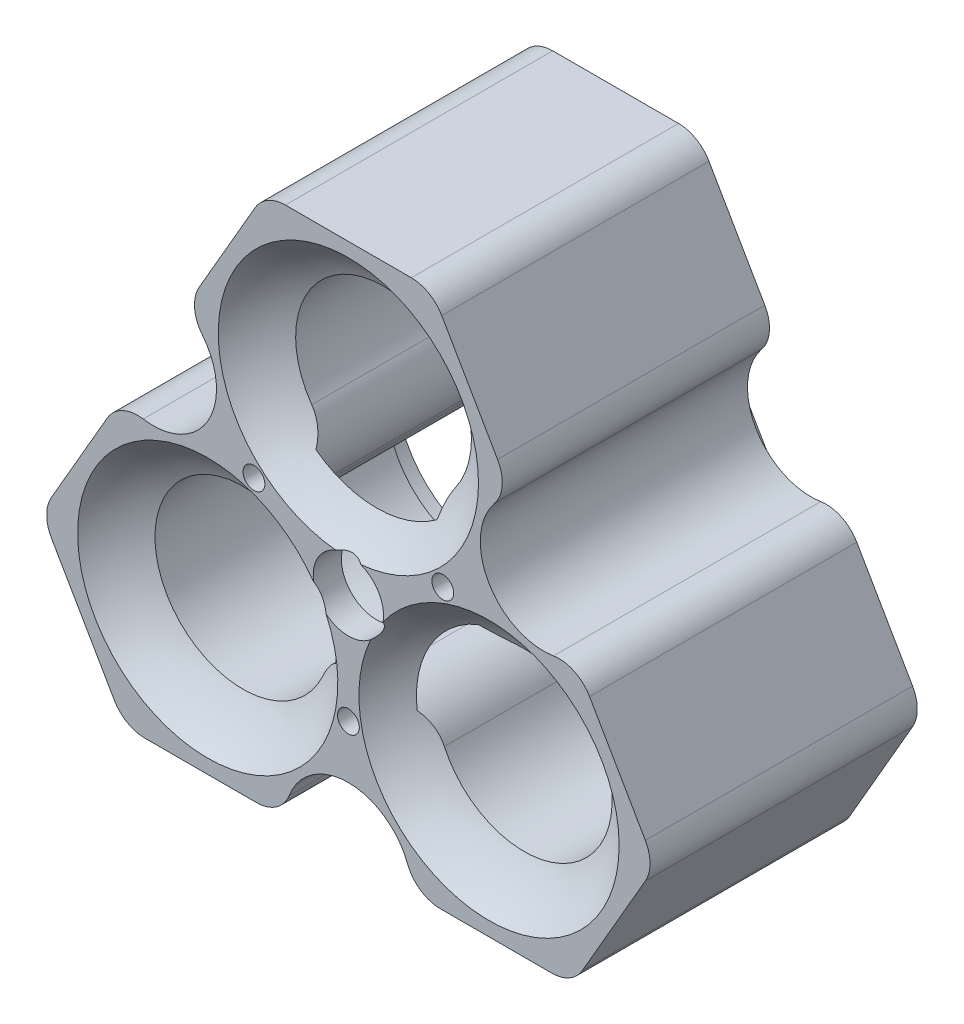
from build123d import *

# Parameters (mm, degrees)
EXTRUDE_3_DEPTH          = 38
CUT_EXTRUDE_2_DEPTH      = 34
PATTERN_CIRCULAR_2_COUNT = 3
SKETCH_1_8_R             = 5
CUT_EXTRUDE_4_DEPTH      = 38
FILLET_2_R               = 5
SKETCH_12_R              = 1.55
CUT_EXTRUDE_5_DEPTH      = 38
SKETCH_17_W              = 6
SKETCH_17_H              = 1.5


with BuildPart() as part:
    # 草图8 → 凸台-拉伸3 (new body)
    with BuildSketch(Plane.XY):
        with BuildLine():
            Line((11.835680518, 43.594010768), (-11.835680518, 43.594010768))
            Line((-11.835680518, 43.594010768), (-23.253520778, 23.817731326))
            ThreePointArc((-23.253520778, 23.817731326), (-19.959292144, 20.523502692), (-18.753520778, 16.023502692))
            ThreePointArc((-18.753520778, 16.023502692), (-23.253520778, 8.229274058), (-32.253520778, 8.229274058))
            Line((-32.253520778, 8.229274058), (-43.671361037, -11.547005384))
            Line((-43.671361037, -11.547005384), (-31.835680518, -32.047005384))
            Line((-31.835680518, -32.047005384), (-9, -32.047005384))
            ThreePointArc((-9, -32.047005384), (0, -23.047005384), (9, -32.047005384))
            Line((9, -32.047005384), (31.835680518, -32.047005384))
            Line((31.835680518, -32.047005384), (43.671361037, -11.547005384))
            Line((43.671361037, -11.547005384), (32.253520778, 8.229274058))
            ThreePointArc((32.253520778, 8.229274058), (19.959292144, 11.523502692), (23.253520778, 23.817731326))
            Line((23.253520778, 23.817731326), (11.835680518, 43.594010768))
        make_face()
    extrude(amount=EXTRUDE_3_DEPTH)

    # 草图1 → 切除-拉伸2 (cut)
    with BuildSketch(Plane.XY):
        with BuildLine():
            ThreePointArc((-10.207581819, 15.879076713), (-8.566497102, 11.096786669), (-9.762812095, 6.184324194))
            Line((-9.762812095, 6.184324194), (-10.237187905, 5.362681189))
            ThreePointArc((-10.237187905, 5.362681189), (-13.893347706, 1.870410777), (-18.855474732, 0.90048681))
            ThreePointArc((-18.855474732, 0.90048681), (-30.825317547, -17.797005384), (-8.647892913, -16.779563523))
            ThreePointArc((-8.647892913, -16.779563523), (-5.326850604, -12.967197446), (-0.47437581, -11.547005384))
            Line((-0.47437581, -11.547005384), (0.47437581, -11.547005384))
            ThreePointArc((0.47437581, -11.547005384), (5.326850604, -12.967197446), (8.647892913, -16.779563523))
            ThreePointArc((8.647892913, -16.779563523), (30.825317547, -17.797005384), (18.855474732, 0.90048681))
            ThreePointArc((18.855474732, 0.90048681), (13.893347706, 1.870410778), (10.237187905, 5.362681189))
            Line((10.237187905, 5.362681189), (9.762812095, 6.184324195))
            ThreePointArc((9.762812095, 6.184324195), (8.566497102, 11.096786669), (10.207581819, 15.879076713))
            ThreePointArc((10.207581819, 15.879076713), (0, 35.594010768), (-10.207581819, 15.879076713))
        make_face()
    extrude(amount=CUT_EXTRUDE_2_DEPTH, mode=Mode.SUBTRACT)

    # 草图10 → 切除-旋转2 (revolve, cut)
    with BuildSketch(Plane(origin=(0, 0, 0), x_dir=(0, 0, -1), z_dir=(1, 0, 0))):
        with BuildLine():
            Line((-38, 41.594010768), (-38, 23.094010768))
            Line((-38, 23.094010768), (-33, 23.094010768))
            Line((-33, 23.094010768), (-33, 35.594010768))
            ThreePointArc((-33, 35.594010768), (-35.102636282, 38.9251472), (-38, 41.594010768))
        make_face()
    cut_revolve_2 = revolve(axis=Axis((0, 23.094010768, 38), (0, 0, -1)), mode=Mode.SUBTRACT)

    # 阵列(圆周)2: 切除-旋转2 ×3 about axis
    pattern_circular_2_axis = Axis((0, 0, 0), (0, 0, 1))
    for i in range(1, PATTERN_CIRCULAR_2_COUNT):
        add(cut_revolve_2.rotate(pattern_circular_2_axis, i * 360 / PATTERN_CIRCULAR_2_COUNT), mode=Mode.SUBTRACT)

    # 草图1<8> → 切除-拉伸4 (cut)
    with BuildSketch(Plane.XY):
        Circle(SKETCH_1_8_R)
    extrude(amount=CUT_EXTRUDE_4_DEPTH, mode=Mode.SUBTRACT)

    # 圆角2
    fillet_2_edges = [part.edges().sort_by_distance(p)[0] for p in [
        (-43.671361037, -11.547005384, 19),
        (-31.835680518, -32.047005384, 19),
        (-9, -32.047005384, 19),
        (9, -32.047005384, 19),
        (31.835680518, -32.047005384, 19),
        (43.671361037, -11.547005384, 19),
        (32.253520778, 8.229274058, 19),
        (23.253520778, 23.817731326, 19),
        (11.835680518, 43.594010768, 19),
        (-11.835680518, 43.594010768, 19),
        (-23.253520778, 23.817731326, 19),
        (-32.253520778, 8.229274058, 19),
    ]]
    fillet(fillet_2_edges, radius=FILLET_2_R)

    # 草图12 → 切除-拉伸5 (cut)
    with BuildSketch(Plane(origin=(0, 0, 0), x_dir=(-1, 0, 0), z_dir=(0, 0, -1))):
        with Locations((-13.423393759, 7.75)):
            Circle(SKETCH_12_R)
        with Locations((13.423393759, 7.75)):
            Circle(SKETCH_12_R)
        with Locations((0, -15.5)):
            Circle(SKETCH_12_R)
    extrude(amount=-CUT_EXTRUDE_5_DEPTH, mode=Mode.SUBTRACT)

    # 扫描1: sweep along a path in 草图13
    with BuildLine(Plane(origin=(0, 0, 0), x_dir=(-1, 0, 0), z_dir=(0, 0, -1))) as sweep_1_path:
        Line((18.316211134, 5.369402481), (13.808144519, 13.177602903))
        ThreePointArc((13.808144519, 13.177602903), (13.276648142, 14.989995098), (13.63598379, 16.844215085))
        ThreePointArc((13.63598379, 16.844215085), (0, 38.094010768), (-13.63598379, 16.844215085))
        ThreePointArc((-13.63598379, 16.844215085), (-13.276648142, 14.989995098), (-13.808144519, 13.177602903))
        Line((-13.808144519, 13.177602903), (-18.316211134, 5.369402481))
        ThreePointArc((-18.316211134, 5.369402481), (-19.620040628, 4.002917019), (-21.405510065, 3.387000825))
        ThreePointArc((-21.405510065, 3.387000825), (-32.990381057, -19.047005384), (-7.769526275, -20.23121591))
        ThreePointArc((-7.769526275, -20.23121591), (-6.343392486, -18.992912117), (-4.508066615, -18.547005384))
        Line((-4.508066615, -18.547005384), (4.508066615, -18.547005384))
        ThreePointArc((4.508066615, -18.547005384), (6.343392486, -18.992912117), (7.769526275, -20.23121591))
        ThreePointArc((7.769526275, -20.23121591), (32.990381057, -19.047005384), (21.405510065, 3.387000825))
        ThreePointArc((21.405510065, 3.387000825), (19.620040628, 4.002917019), (18.316211134, 5.369402481))
    # 草图17 → 扫描1 (sweep)
    with BuildSketch(Plane(origin=(0, 0, 0), x_dir=(0, 0, -1), z_dir=(1, 0, 0))):
        with Locations((0, 38.094010768)):
            Rectangle(SKETCH_17_W, SKETCH_17_H)
    sweep(path=sweep_1_path.line)


solid = part.part
